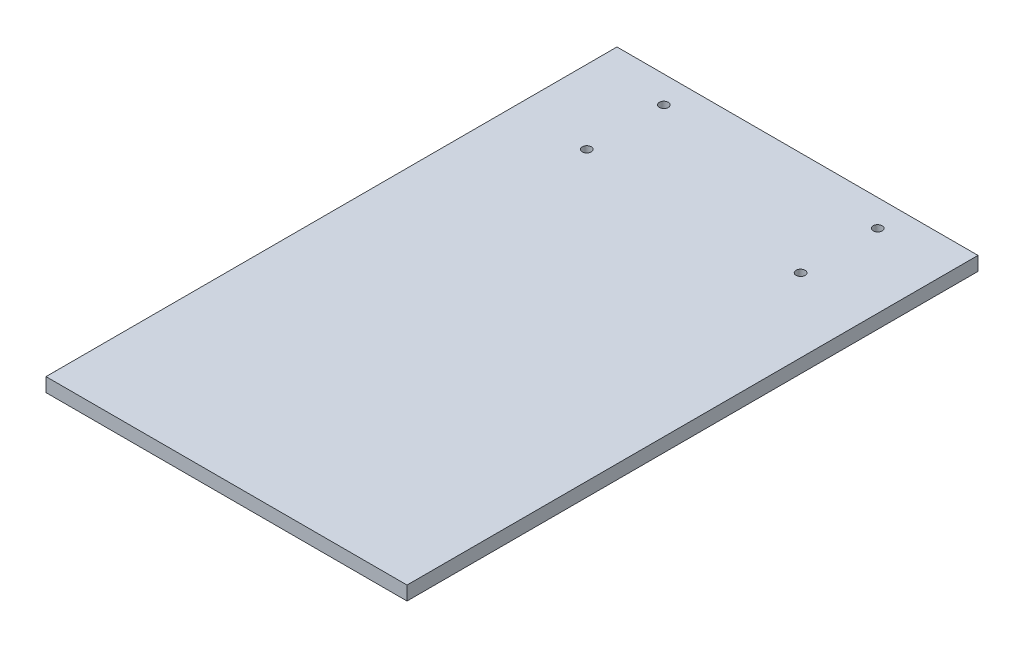
from build123d import *

# Parameters (mm, degrees)
CROQUIS2_W              = 260
CROQUIS2_H              = 411.2
SALIENTE_EXTRUIR1_DEPTH = 5
CROQUIS3_R              = 3.25
CORTAR_EXTRUIR1_DEPTH   = 244.457100944


with BuildPart() as part:
    # Croquis2 → Saliente-Extruir1 (new, symmetric)
    with BuildSketch(Plane(origin=(0, 0, 0), x_dir=(1, 0, 0), z_dir=(0, 1, 0))):
        Rectangle(CROQUIS2_W, CROQUIS2_H)
    extrude(amount=SALIENTE_EXTRUIR1_DEPTH, both=True)

    # Croquis3 → Cortar-Extruir1 (cut, through all)
    with BuildSketch(Plane(origin=(0, 5, 0), x_dir=(1, 0, 0), z_dir=(0, 1, 0))):
        with Locations(Location((77, 186.35, 0), (0, 0, 90))):
            Circle(CROQUIS3_R)
        with Locations(Location((77, 130.85, 0), (0, 0, 270))):
            Circle(CROQUIS3_R)
        with Locations(Location((-77, 186.35, 0), (0, 0, 270))):
            Circle(CROQUIS3_R)
        with Locations(Location((-77, 130.85, 0), (0, 0, 90))):
            Circle(CROQUIS3_R)
    extrude(amount=-CORTAR_EXTRUIR1_DEPTH, mode=Mode.SUBTRACT)


solid = part.part
